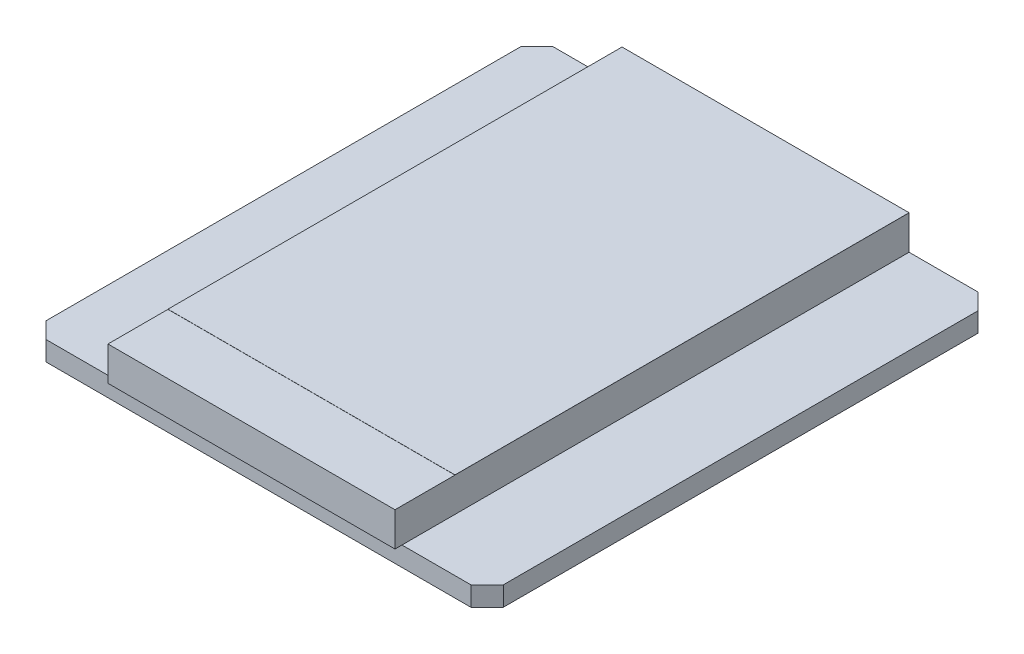
from build123d import *

# Parameters (mm, degrees)
EXTRUDE_1_DEPTH = 1.2
SKETCH_2_W      = 17.7
SKETCH_2_H      = 31.7
EXTRUDE_2_DEPTH = 2.1
SKETCH_3_W      = 17.7
SKETCH_3_H      = 28
EXTRUDE_3_DEPTH = 0.01


with BuildPart() as part:
    # Эскиз1 → Бобышка-Вытянуть1 (new body)
    with BuildSketch(Plane(origin=(0, 0, 0), x_dir=(1, 0, 0), z_dir=(0, 1, 0))):
        Polygon((-14.1, 14.635), (-13.1, 15.635), (13.1, 15.635), (14.1, 14.635), (14.1, -14.635), (13.1, -15.635), (-13.1, -15.635), (-14.1, -14.635), align=None)
    extrude(amount=EXTRUDE_1_DEPTH)


with BuildPart() as body_2:
    # Эскиз2 → Бобышка-Вытянуть2 (new body)
    with BuildSketch(Plane(origin=(0, 1.2, 0), x_dir=(1, 0, 0), z_dir=(0, 1, 0))):
        with Locations((0, -0.215)):
            Rectangle(SKETCH_2_W, SKETCH_2_H)
    extrude(amount=EXTRUDE_2_DEPTH)


with BuildPart() as body_3:
    # Эскиз3 → Бобышка-Вытянуть3 (new body)
    with BuildSketch(Plane(origin=(0, 3.3, 0), x_dir=(1, 0, 0), z_dir=(0, 1, 0))):
        with Locations((0, 1.635)):
            Rectangle(SKETCH_3_W, SKETCH_3_H)
    extrude(amount=EXTRUDE_3_DEPTH)


solid = Compound([part.part, body_2.part, body_3.part])
